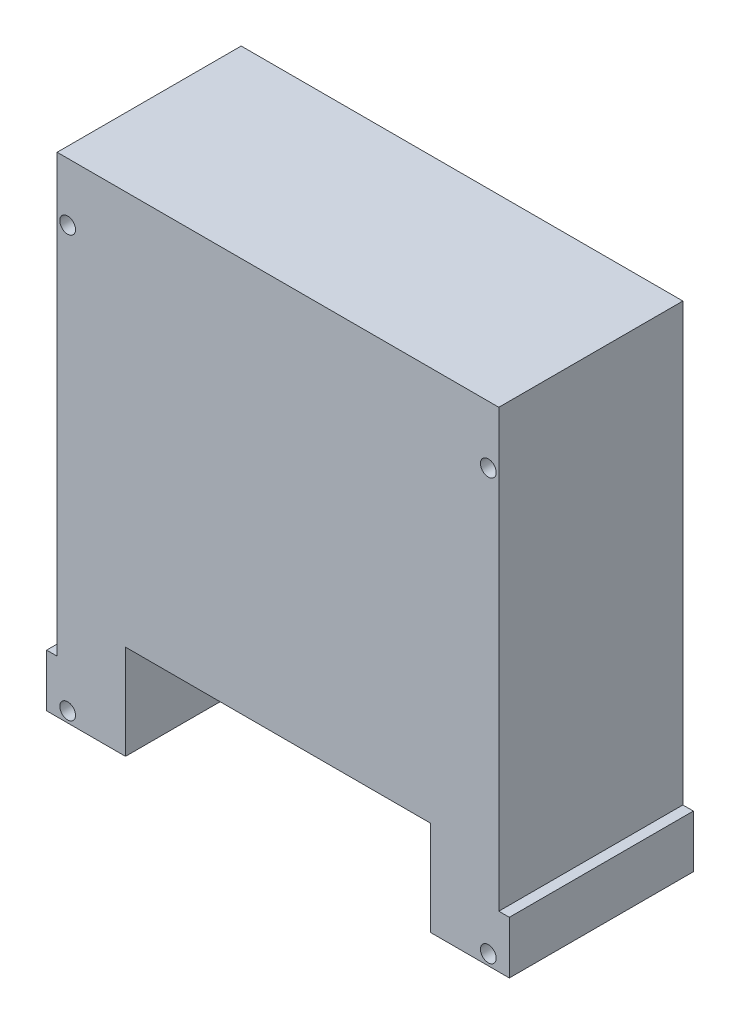
from build123d import *

# Parameters (mm, degrees)
SKETCH_1_W          = 84
SKETCH_1_H          = 93
EXTRUDE_1_DEPTH     = 35
CUT_EXTRUDE_1_REACH = 132.115
SKETCH_2_R          = 1.5
CUT_EXTRUDE_2_REACH = 132.115
SKETCH_3_W          = 58
SKETCH_3_H          = 18
SKETCH_6_W          = 35
SKETCH_6_H          = 10
EXTRUDE_3_DEPTH     = 2


with BuildPart() as part:
    # 草图1 → 凸台-拉伸1 (new body)
    with BuildSketch(Plane.XY):
        with Locations((42, 46.5)):
            Rectangle(SKETCH_1_W, SKETCH_1_H)
    extrude(amount=EXTRUDE_1_DEPTH)

    # 草图2 → 切除-拉伸1 (cut, up to next)
    with BuildSketch(Plane.XY.offset(35), mode=Mode.PRIVATE) as cut_extrude_1_sk1:
        with Locations((82, 2)):
            Circle(SKETCH_2_R)
    cut_extrude_1_tool1 = extrude(cut_extrude_1_sk1.sketch, amount=-CUT_EXTRUDE_1_REACH, mode=Mode.PRIVATE) & part.part
    # 草图2 → 切除-拉伸1 (cut, up to next)
    with BuildSketch(Plane.XY.offset(35), mode=Mode.PRIVATE) as cut_extrude_1_sk2:
        with Locations((2, 2)):
            Circle(SKETCH_2_R)
    cut_extrude_1_tool2 = extrude(cut_extrude_1_sk2.sketch, amount=-CUT_EXTRUDE_1_REACH, mode=Mode.PRIVATE) & part.part
    # 草图2 → 切除-拉伸1 (cut, up to next)
    with BuildSketch(Plane.XY.offset(35), mode=Mode.PRIVATE) as cut_extrude_1_sk3:
        with Locations((82, 82)):
            Circle(SKETCH_2_R)
    cut_extrude_1_tool3 = extrude(cut_extrude_1_sk3.sketch, amount=-CUT_EXTRUDE_1_REACH, mode=Mode.PRIVATE) & part.part
    # 草图2 → 切除-拉伸1 (cut, up to next)
    with BuildSketch(Plane.XY.offset(35), mode=Mode.PRIVATE) as cut_extrude_1_sk4:
        with Locations((2, 82)):
            Circle(SKETCH_2_R)
    cut_extrude_1_tool4 = extrude(cut_extrude_1_sk4.sketch, amount=-CUT_EXTRUDE_1_REACH, mode=Mode.PRIVATE) & part.part
    add(cut_extrude_1_tool1.solids().sort_by_distance((82, 2, 35))[0], mode=Mode.SUBTRACT)
    add(cut_extrude_1_tool2.solids().sort_by_distance((2, 2, 35))[0], mode=Mode.SUBTRACT)
    add(cut_extrude_1_tool3.solids().sort_by_distance((82, 82, 35))[0], mode=Mode.SUBTRACT)
    add(cut_extrude_1_tool4.solids().sort_by_distance((2, 82, 35))[0], mode=Mode.SUBTRACT)

    # 草图3 → 切除-拉伸2 (cut, up to next)
    with BuildSketch(Plane.XY.offset(35), mode=Mode.PRIVATE) as cut_extrude_2_sk1:
        with Locations((42, 9)):
            Rectangle(SKETCH_3_W, SKETCH_3_H)
    cut_extrude_2_tool1 = extrude(cut_extrude_2_sk1.sketch, amount=-CUT_EXTRUDE_2_REACH, mode=Mode.PRIVATE) & part.part
    add(cut_extrude_2_tool1.solids().sort_by_distance((42, 9, 35))[0], mode=Mode.SUBTRACT)

    # 草图6 → 凸台-拉伸3 (add)
    with BuildSketch(Plane(origin=(84, 0, 0), x_dir=(0, 0, -1), z_dir=(1, 0, 0))):
        with Locations((-17.5, 5)):
            Rectangle(SKETCH_6_W, SKETCH_6_H)
    extrude_3 = extrude(amount=EXTRUDE_3_DEPTH)

    # 镜向1: 凸台-拉伸3 across plane
    add(extrude_3.mirror(Plane(origin=(42, 0, 0), x_dir=(0, 0, 1), z_dir=(1, 0, 0))))


solid = part.part
